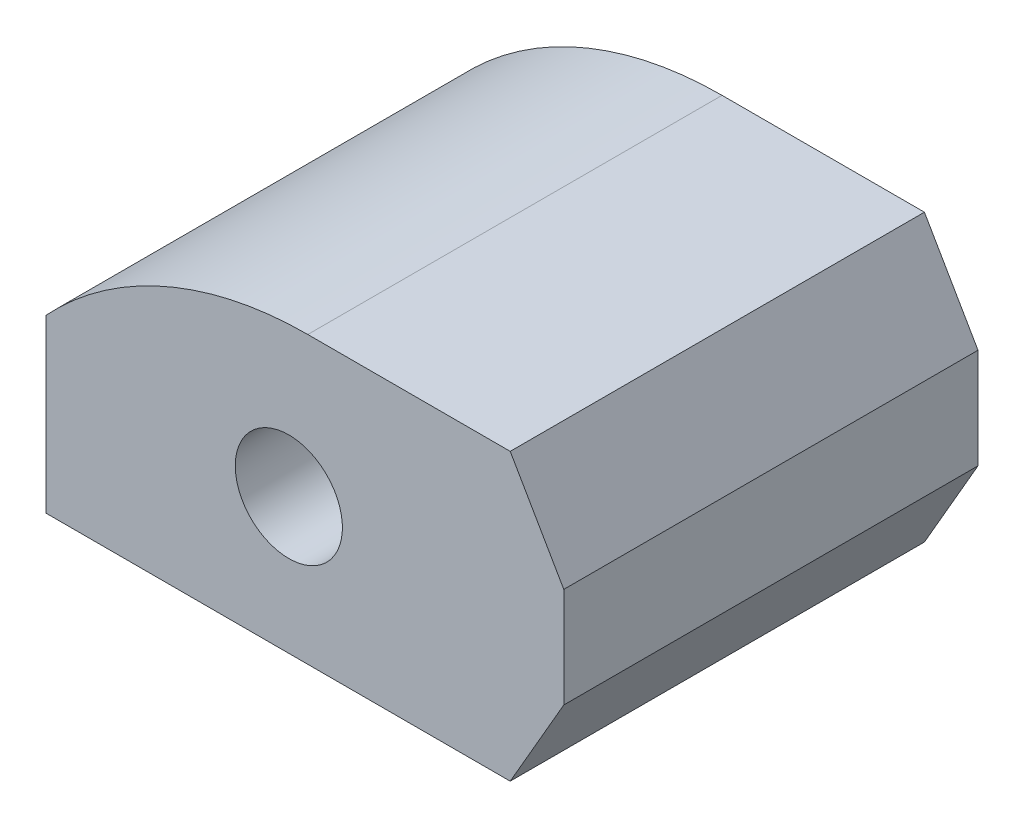
from build123d import *

# Parameters (mm, degrees)
SKETCH1_R           = 7.5
BOSS_EXTRUDE2_DEPTH = 58


with BuildPart() as part:
    # Sketch1 → Boss-Extrude2 (new body)
    with BuildSketch(Plane.XY):
        with BuildLine():
            Line((-34, 5), (-34, -19))
            Line((-34, -19), (31, -19))
            Line((31, -19), (38.5, -6.009618943))
            Line((38.5, -6.009618943), (38.5, 8.009618943))
            Line((38.5, 8.009618943), (31, 21))
            Line((31, 21), (2.66060556, 21))
            ThreePointArc((2.66060556, 21), (-17.33939444, 16.82575695), (-34, 5))
        make_face()
        with Locations(Location((0, 0, 0), (0, 0, 180))):
            Circle(SKETCH1_R, mode=Mode.SUBTRACT)
    extrude(amount=BOSS_EXTRUDE2_DEPTH)


solid = part.part
